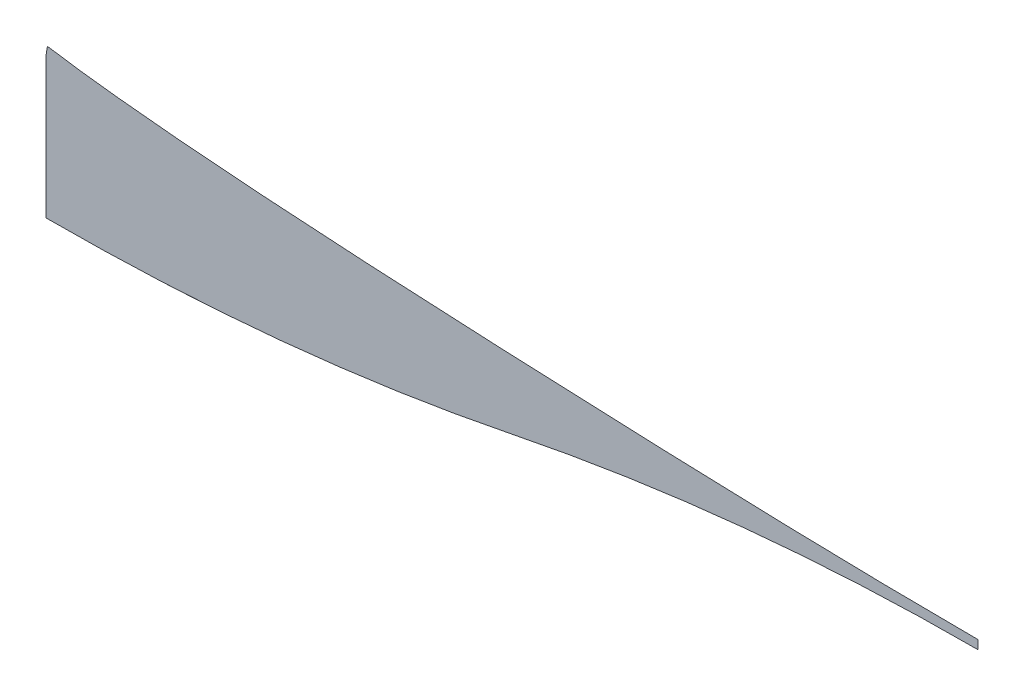
from build123d import *

# Parameters (mm, degrees)
BOSS_EXTRUDE1_DEPTH = 0.0001778


with BuildPart() as part:
    # Sketch1 → Boss-Extrude1 (new body)
    with BuildSketch(Plane.XY):
        with BuildLine():
            add(Edge.make_bspline(
                [(-2512.043123723, -12.658699204), (-2510.054516109, -12.982577579), (-2506.091386595, -13.622923371), (-2498.042759678, -14.903219145), (-2487.836149169, -16.489493186), (-2475.332437705, -18.374960113), (-2458.333631626, -20.863671926), (-2436.476202003, -23.928516792), (-2409.302935957, -27.534170731), (-2381.214018357, -31.069270133), (-2342.580611439, -35.690527324), (-2292.147579141, -41.297541749), (-2228.44208922, -47.764331788), (-2161.793566025, -53.978340482), (-2092.446728836, -59.947910487), (-1996.719198485, -67.592672856), (-1871.563093469, -76.579315743), (-1714.568596677, -86.517592644), (-1552.761618525, -95.674011047), (-1388.107475048, -104.112588093), (-1250.138794963, -110.59947135), (-1140.260747115, -115.493320111), (-1058.325619128, -119.02447596), (-977.053458684, -122.426989504), (-897.242215664, -125.674158083), (-818.712690962, -128.759488748), (-715.554683808, -132.650116292), (-589.24959068, -137.080108779), (-441.110930622, -141.649435), (-295.695003648, -145.410785117), (-152.356622959, -148.29649633), (-10.498921915, -150.218189422), (85.995456827, -150.81364483), (135.447924171, -150.901191305), (137.956876277, -150.905068917)],
                knots=[0.255847657, 0.255847657, 0.255847657, 0.255847657, 0.257796247, 0.259744837, 0.263642018, 0.267539199, 0.271436379, 0.27923074, 0.287025101, 0.294819463, 0.302613824, 0.318202546, 0.333791268, 0.349379991, 0.364968713, 0.380557435, 0.41173488, 0.442912324, 0.474089769, 0.505267213, 0.536444658, 0.55203338, 0.567622103, 0.583210825, 0.598799547, 0.614388269, 0.629976992, 0.661154436, 0.692331881, 0.723509325, 0.75468677, 0.785864215, 0.817041659, 0.818708055, 0.818708055, 0.818708055, 0.818708055], degree=3))
            Line((-2512.043123723, -12.658699204), (-2512.043123723, -412.658699204))
            add(Edge.make_bspline(
                [(-1187.043123723, -282.658699204), (-1624.829879504, -371.296418893), (-2064.018601931, -412.658699204), (-2512.043123723, -412.658699204)],
                knots=[0, 0, 0, 0, 1, 1, 1, 1], degree=3))
            ThreePointArc((-1187.043123723, -282.658699204), (-527.861387699, -183.411268324), (137.956876277, -150.905068917))
        make_face()
        with BuildLine():
            Line((-2508.024401726, 12.016184251), (-2512.043123723, -12.658699204))
            add(Edge.make_bspline(
                [(-2512.043123723, -12.658699204), (-2510.054516109, -12.982577579), (-2506.091386595, -13.622923371), (-2498.042759678, -14.903219145), (-2487.836149169, -16.489493186), (-2475.332437705, -18.374960113), (-2458.333631626, -20.863671926), (-2436.476202003, -23.928516792), (-2409.302935957, -27.534170731), (-2381.214018357, -31.069270133), (-2342.580611439, -35.690527324), (-2292.147579141, -41.297541749), (-2228.44208922, -47.764331788), (-2161.793566025, -53.978340482), (-2092.446728836, -59.947910487), (-1996.719198485, -67.592672856), (-1871.563093469, -76.579315743), (-1714.568596677, -86.517592644), (-1552.761618525, -95.674011047), (-1388.107475048, -104.112588093), (-1250.138794963, -110.59947135), (-1140.260747115, -115.493320111), (-1058.325619128, -119.02447596), (-977.053458684, -122.426989504), (-897.242215664, -125.674158083), (-818.712690962, -128.759488748), (-715.554683808, -132.650116292), (-589.24959068, -137.080108779), (-441.110930622, -141.649435), (-295.695003648, -145.410785117), (-152.356622959, -148.29649633), (-10.498921915, -150.218189422), (85.995456827, -150.81364483), (135.447924171, -150.901191305), (137.956876277, -150.905068917)],
                knots=[0.255847657, 0.255847657, 0.255847657, 0.255847657, 0.257796247, 0.259744837, 0.263642018, 0.267539199, 0.271436379, 0.27923074, 0.287025101, 0.294819463, 0.302613824, 0.318202546, 0.333791268, 0.349379991, 0.364968713, 0.380557435, 0.41173488, 0.442912324, 0.474089769, 0.505267213, 0.536444658, 0.55203338, 0.567622103, 0.583210825, 0.598799547, 0.614388269, 0.629976992, 0.661154436, 0.692331881, 0.723509325, 0.75468677, 0.785864215, 0.817041659, 0.818708055, 0.818708055, 0.818708055, 0.818708055], degree=3))
            Line((137.956876277, -150.905068917), (137.956876277, -125.905045826))
            add(Edge.make_bspline(
                [(137.956876277, -125.905045826), (90.447578033, -125.831466969), (-51.157679371, -125.009000413), (-241.571680644, -121.779938852), (-435.623631421, -116.795611583), (-583.89462031, -112.243684307), (-735.605527533, -106.939667032), (-865.564761, -101.937822414), (-958.768657742, -98.151766972), (-1012.774918748, -95.909487536), (-1094.326010114, -92.474741575), (-1217.952390669, -87.079235245), (-1383.807646154, -79.293536673), (-1548.760756574, -70.853344494), (-1764.88706881, -58.642627354), (-1971.322893498, -44.869434749), (-2254.31940598, -21.490500859), (-2413.84111278, -3.323156895), (-2508.024401726, 12.016184251)],
                knots=[0.18396067, 0.18396067, 0.18396067, 0.18396067, 0.215562491, 0.278062491, 0.309312491, 0.340562491, 0.371812491, 0.403062491, 0.418687491, 0.426499991, 0.434312491, 0.465562491, 0.496812491, 0.528062491, 0.559312491, 0.621812491, 0.653062491, 0.746812491, 0.746812491, 0.746812491, 0.746812491], degree=3))
        make_face()
    extrude(amount=BOSS_EXTRUDE1_DEPTH)


solid = part.part
